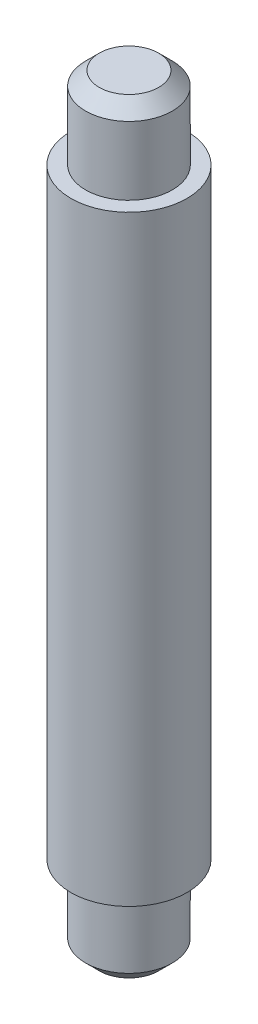
from build123d import *

# Parameters (mm, degrees)
ESBO_O1_R                     = 4.25
RESSALTO_EXTRUS_O1_DEPTH      = 44
RESSALTO_EXTRUS_O2_DEPTH      = 6
RESSALTO_EXTRUS_O2_DEPTH_BACK = 50
ESBO_O2_R                     = 3.175
CHANFRO1_SIZE                 = 1
CHANFRO2_SIZE                 = 1


with BuildPart() as part:
    # Esboço1 → Ressalto-extrusão1 (new body)
    with BuildSketch(Plane(origin=(0, 0, 0), x_dir=(1, 0, 0), z_dir=(0, 1, 0))):
        with Locations(Location((0, 0, 0), (0, 0, 270))):
            Circle(ESBO_O1_R)
    extrude(amount=RESSALTO_EXTRUS_O1_DEPTH)

    # Esboço2 → Ressalto-extrusão2 (add, two sides: drawn at the far end of the back side and taken through both)
    with BuildSketch(Plane(origin=(0, 0, 0), x_dir=(-1, 0, 0), z_dir=(0, -1, 0)).offset(-RESSALTO_EXTRUS_O2_DEPTH_BACK)):
        with Locations(Location((0, 0, 0), (0, 0, 270))):
            Circle(ESBO_O2_R)
    extrude(amount=RESSALTO_EXTRUS_O2_DEPTH + RESSALTO_EXTRUS_O2_DEPTH_BACK)

    # Chanfro1
    chanfro1_edges = [part.edges().sort_by_distance(p)[0] for p in [
        (0, -6, -3.175),
    ]]
    chamfer(chanfro1_edges, length=CHANFRO1_SIZE)

    # Chanfro2
    chanfro2_edges = [part.edges().sort_by_distance(p)[0] for p in [
        (0, 50, -3.175),
    ]]
    chamfer(chanfro2_edges, length=CHANFRO2_SIZE)


solid = part.part
